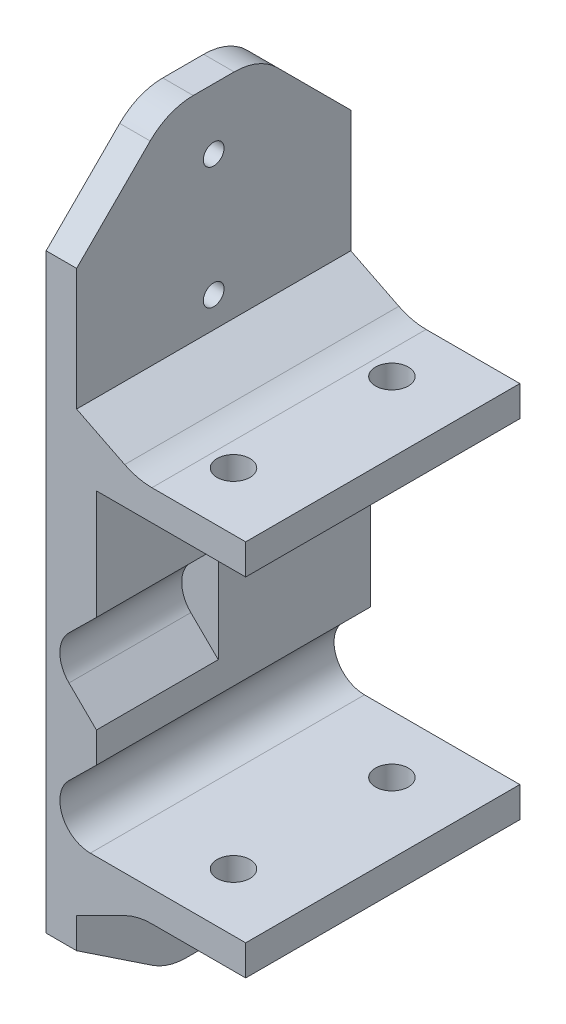
from build123d import *

# Parameters (mm, degrees)
BOSS_EXTRUDE1_DEPTH     = 45
SKETCH3_R               = 1.7
CUT_EXTRUDE1_DEPTH      = 111.471998715
CHAMFER1_SIZE           = 5
CHAMFER1_SIZE2          = 10
CHAMFER2_SIZE           = 10
CHAMFER2_SIZE2          = 5
FILLET1_R               = 10
CUT_EXTRUDE2_DEPTH      = 112.832743416
CUT_EXTRUDE2_DEPTH_BACK = 112.832743416
SKETCH5_R               = 2.7
CUT_EXTRUDE3_DEPTH      = 112.832743416
CUT_EXTRUDE4_DEPTH      = 20


with BuildPart() as part:
    # Sketch1 → Boss-Extrude1 (new body)
    with BuildSketch(Plane.XY):
        Polygon((0, 0), (0, -5), (-27.75, -5), (-27.75, -25), (-32.75, -25), (-32.75, 97), (-27.75, 97), (-27.75, 57), (0, 57), (0, 52), (-24.5, 52), (-24.5, 0), align=None)
    extrude(amount=BOSS_EXTRUDE1_DEPTH)

    # Sketch3 → Cut-Extrude1 (cut, through all)
    with BuildSketch(Plane(origin=(-27.75, 0, 0), x_dir=(0, 0, -1), z_dir=(1, 0, 0))):
        Polygon((-45, 97), (-45, 82), (-30, 97), align=None)
        Polygon((-15, 97), (0, 82), (0, 97), align=None)
        Polygon((-30, -25), (-45, -15), (-45, -25), align=None)
        Polygon((0, -25), (0, -15), (-15, -25), align=None)
        with Locations(Location((-22.5, -15, 0), (0, 0, 90))):
            Circle(SKETCH3_R)
        with Locations(Location((-22.5, 87, 0), (0, 0, 90))):
            Circle(SKETCH3_R)
        with Locations(Location((-22.5, 67, 0), (0, 0, 90))):
            Circle(SKETCH3_R)
    extrude(amount=-CUT_EXTRUDE1_DEPTH, mode=Mode.SUBTRACT)

    # Chamfer1
    chamfer1_edges = [part.edges().sort_by_distance(p)[0] for p in [
        (-27.75, -5, 22.5),
    ]]
    chamfer1_side = [part.faces().sort_by_distance(p)[0] for p in [
        (-27.75, -10, 0.49244289),
    ]]
    chamfer(chamfer1_edges, length=CHAMFER1_SIZE, length2=CHAMFER1_SIZE2, reference=chamfer1_side[0])

    # Chamfer2
    chamfer2_edges = [part.edges().sort_by_distance(p)[0] for p in [
        (-27.75, 57, 22.5),
    ]]
    chamfer2_side = [part.faces().sort_by_distance(p)[0] for p in [
        (-13.875, 57, 22.5),
    ]]
    chamfer(chamfer2_edges, length=CHAMFER2_SIZE, length2=CHAMFER2_SIZE2, reference=chamfer2_side[0])

    # Fillet1
    fillet1_edges = [part.edges().sort_by_distance(p)[0] for p in [
        (-17.75, 57, 22.5),
        (-30.25, -25, 15),
        (-30.25, -25, 30),
        (-30.25, 97, 15),
        (-30.25, 97, 30),
        (-17.75, -5, 22.5),
    ]]
    fillet(fillet1_edges, radius=FILLET1_R)

    # Sketch5 → Cut-Extrude2 (cut, two sides: drawn at the far end of the back side and taken through both)
    with BuildSketch(Plane(origin=(0, 0, 0), x_dir=(1, 0, 0), z_dir=(0, 1, 0)).offset(-CUT_EXTRUDE2_DEPTH_BACK)):
        with Locations(Location((-11.5, -9.5, 0), (0, 0, 270))):
            Circle(SKETCH5_R)
        with Locations(Location((-11.5, -35.5, 0), (0, 0, 270))):
            Circle(SKETCH5_R)
    extrude(amount=CUT_EXTRUDE2_DEPTH + CUT_EXTRUDE2_DEPTH_BACK, mode=Mode.SUBTRACT)

    # Sketch6 → Cut-Extrude3 (cut, through all)
    with BuildSketch(Plane.XY.offset(45)):
        with BuildLine():
            Line((-24.5, 13), (-29.007418659, 8.563427332))
            ThreePointArc((-29.007418659, 8.563427332), (-30.126939413, 3.104892702), (-25.5, 0))
            Line((-25.5, 0), (-24.5, 0))
            Line((-24.5, 0), (-24.5, 13))
        make_face()
    extrude(amount=-CUT_EXTRUDE3_DEPTH, mode=Mode.SUBTRACT)

    # Sketch7 → Cut-Extrude4 (cut)
    with BuildSketch(Plane.XY.offset(45)):
        with BuildLine():
            Line((-24.5, 18), (-24.5, 34))
            Line((-24.5, 34), (-29.007418659, 29.563427332))
            ThreePointArc((-29.007418659, 29.563427332), (-30.5, 26), (-29.007418659, 22.436572668))
            Line((-29.007418659, 22.436572668), (-24.5, 18))
        make_face()
    extrude(amount=-CUT_EXTRUDE4_DEPTH, mode=Mode.SUBTRACT)


solid = part.part
